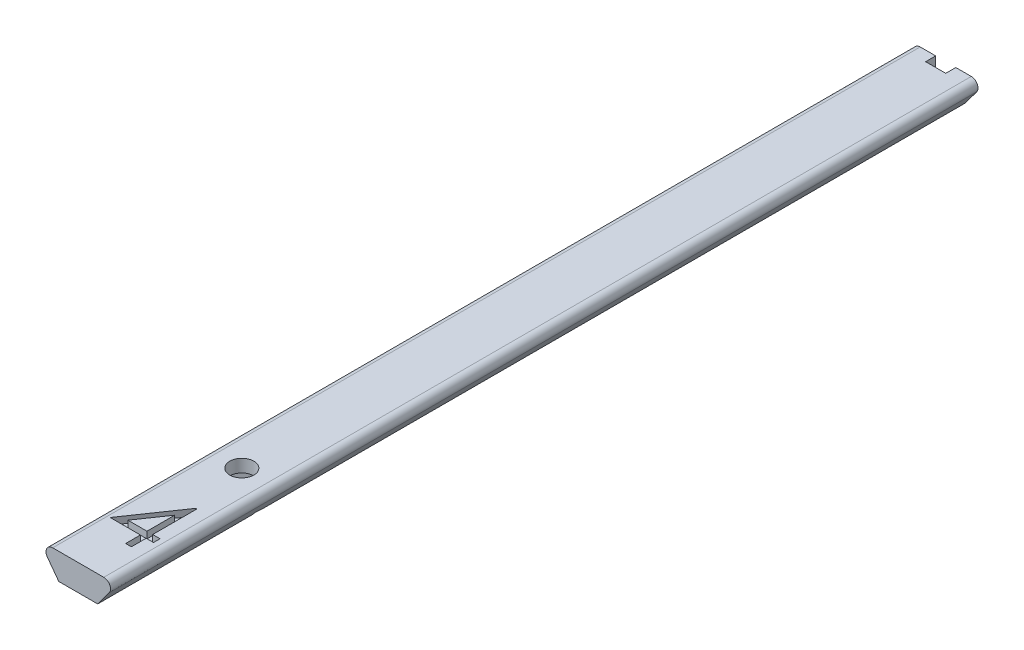
from build123d import *

# Parameters (mm, degrees)
BOSS_EXTRUDE1_DEPTH = 171.2
FILLET1_R           = 1
SKETCH2_R           = 1.8
CUT_EXTRUDE1_DEPTH  = 200
CUT_EXTRUDE2_DEPTH  = 2
LPATTERN1_COUNT     = 3
LPATTERN1_PITCH     = 116
CUT_EXTRUDE3_DEPTH  = 1
THICKEN1_T1         = 40
SKETCH5_W           = 43.187551832
SKETCH5_H           = 200
CUT_EXTRUDE4_DEPTH  = 10
SKETCH7_W           = 3
SKETCH7_H           = 3
CUT_EXTRUDE5_DEPTH  = 2


with BuildPart() as part:
    # Sketch1 → Boss-Extrude1 (new body)
    with BuildSketch(Plane.XY):
        Polygon((0, 0), (5.8, 0), (8.7, 3.9), (-2.9, 3.9), align=None)
    extrude(amount=BOSS_EXTRUDE1_DEPTH)

    # Fillet1
    fillet1_edges = [part.edges().sort_by_distance(p)[0] for p in [
        (-2.9, 3.9, 85.6),
        (8.7, 3.9, 85.6),
    ]]
    fillet(fillet1_edges, radius=FILLET1_R)

    # Sketch2 → Cut-Extrude1 (cut)
    with BuildSketch(Plane.XZ):
        with Locations(Location((2.9, 146.8, 0), (0, 0, 270))):
            Circle(SKETCH2_R)
    cut_extrude1 = extrude(amount=-CUT_EXTRUDE1_DEPTH, mode=Mode.SUBTRACT)

    # Sketch3 → Cut-Extrude2 (cut)
    with BuildSketch(Plane.XZ):
        Polygon((3.536306697, 150.087620282), (0.370990666, 148.994867905), (-0.265316031, 145.707247623), (2.263693303, 143.512379718), (5.429009334, 144.605132095), (6.065316031, 147.892752377), align=None)
    cut_extrude2 = extrude(amount=-CUT_EXTRUDE2_DEPTH, mode=Mode.SUBTRACT)

    # LPattern1: Cut-Extrude1, Cut-Extrude2 ×3
    with Locations(*[(0, 0, -i * LPATTERN1_PITCH) for i in range(1, LPATTERN1_COUNT)]):
        add(cut_extrude1, mode=Mode.SUBTRACT)
        add(cut_extrude2, mode=Mode.SUBTRACT)

    # Sketch4 → Cut-Extrude3 (cut)
    with BuildSketch(Plane(origin=(0, 3.9, 0), x_dir=(1, 0, 0), z_dir=(0, 1, 0))):
        Polygon((4.655544406, -155.430769231), (4.829177218, -155.430769231), (4.829177218, -162.025), (5.92821568, -162.025), (5.92821568, -163.001923077), (4.829177218, -163.001923077), (4.829177218, -165.2), (3.974369526, -165.2), (3.974369526, -163.001923077), (-0.543899705, -163.001923077), align=None)
        Polygon((3.974369526, -162.025), (3.974369526, -157.888341346), (1.135186834, -162.025), align=None, mode=Mode.SUBTRACT)
    extrude(amount=-CUT_EXTRUDE3_DEPTH, mode=Mode.SUBTRACT)

    # Surface-Offset1: a surface, a copy of 1 face of the part
    surface_offset1_1 = part.part.faces().sort_by_distance((2.9, 2.093393293, 0))[0]
    add(Solid.thicken(surface_offset1_1, THICKEN1_T1))

    # Sketch5 → Cut-Extrude4 (cut)
    with BuildSketch(Plane(origin=(0, 3.9, 0), x_dir=(1, 0, 0), z_dir=(0, 1, 0))):
        with Locations((8.67861609, 58.2)):
            Rectangle(SKETCH5_W, SKETCH5_H)
    extrude(amount=-CUT_EXTRUDE4_DEPTH, mode=Mode.SUBTRACT)

    # Sketch7 → Cut-Extrude5 (cut)
    with BuildSketch(Plane(origin=(0, 3.9, 0), x_dir=(1, 0, 0), z_dir=(0, 1, 0))):
        with Locations((2.9, -41.8)):
            Rectangle(SKETCH7_W, SKETCH7_H)
    extrude(amount=-CUT_EXTRUDE5_DEPTH, mode=Mode.SUBTRACT)


solid = part.part
